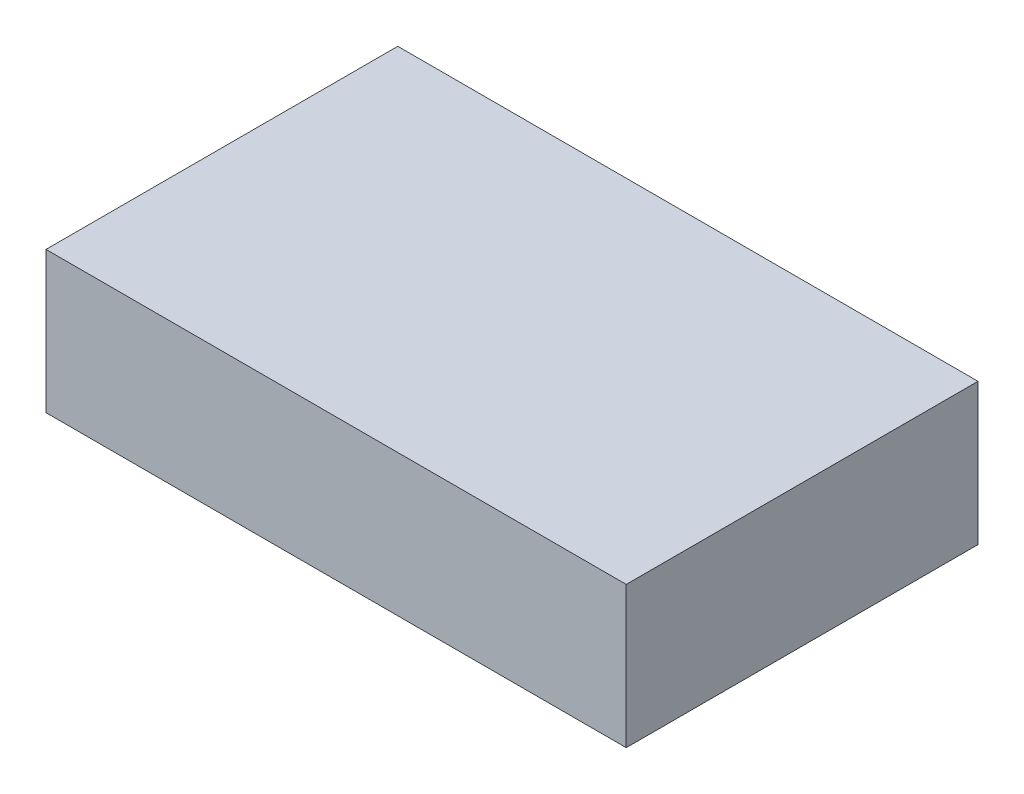
from build123d import *

# Parameters (mm, degrees)
SKETCH1_W           = 160
SKETCH1_H           = 97
BOSS_EXTRUDE1_DEPTH = 39


with BuildPart() as part:
    # Sketch1 → Boss-Extrude1 (new body)
    with BuildSketch(Plane(origin=(0, 0, 0), x_dir=(1, 0, 0), z_dir=(0, 1, 0))):
        Rectangle(SKETCH1_W, SKETCH1_H)
    extrude(amount=BOSS_EXTRUDE1_DEPTH)


solid = part.part
